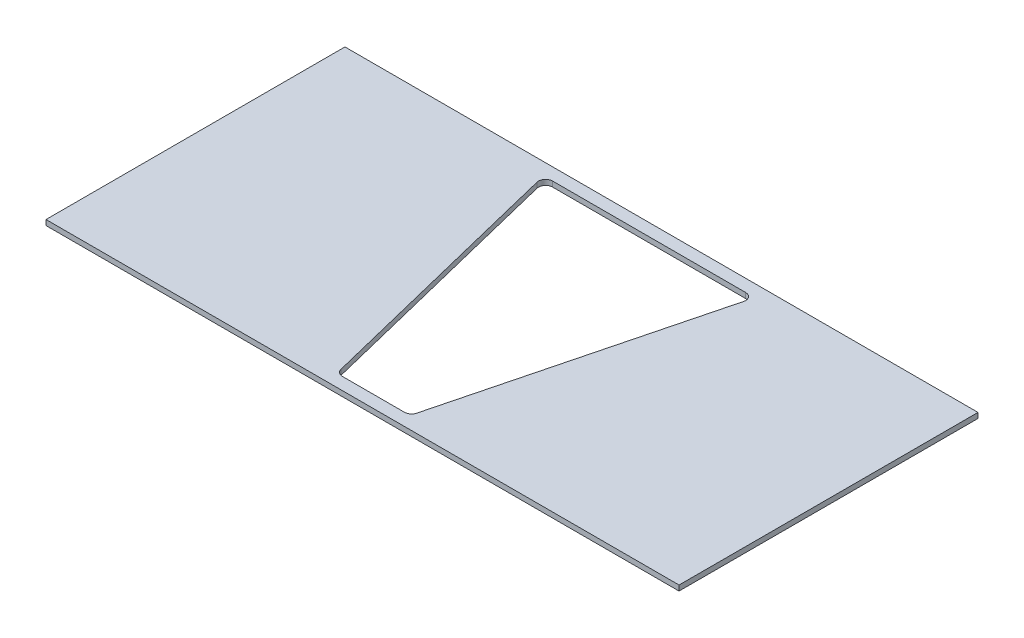
from build123d import *

# Parameters (mm, degrees)
SKETCH1_W           = 1800
SKETCH1_H           = 850
BOSS_EXTRUDE1_DEPTH = 7.5
CUT_EXTRUDE1_DEPTH  = 480
FILLET1_R           = 20


with BuildPart() as part:
    # Sketch1 → Boss-Extrude1 (new, symmetric)
    with BuildSketch(Plane(origin=(0, 0, 0), x_dir=(1, 0, 0), z_dir=(0, 1, 0))):
        Rectangle(SKETCH1_W, SKETCH1_H)
    extrude(amount=BOSS_EXTRUDE1_DEPTH, both=True)

    # Sketch2 → Cut-Extrude1 (cut)
    with BuildSketch(Plane(origin=(0, 7.5, 0), x_dir=(1, 0, 0), z_dir=(0, 1, 0))):
        Polygon((-300, 390), (300, 390), (100, -390), (-108, -390), align=None)
    extrude(amount=-CUT_EXTRUDE1_DEPTH, mode=Mode.SUBTRACT)

    # Fillet1
    fillet1_edges = [part.edges().sort_by_distance(p)[0] for p in [
        (-108, 0, 390),
        (-300, 0, -390),
        (300, 0, -390),
        (100, 0, 390),
    ]]
    fillet(fillet1_edges, radius=FILLET1_R)


solid = part.part
